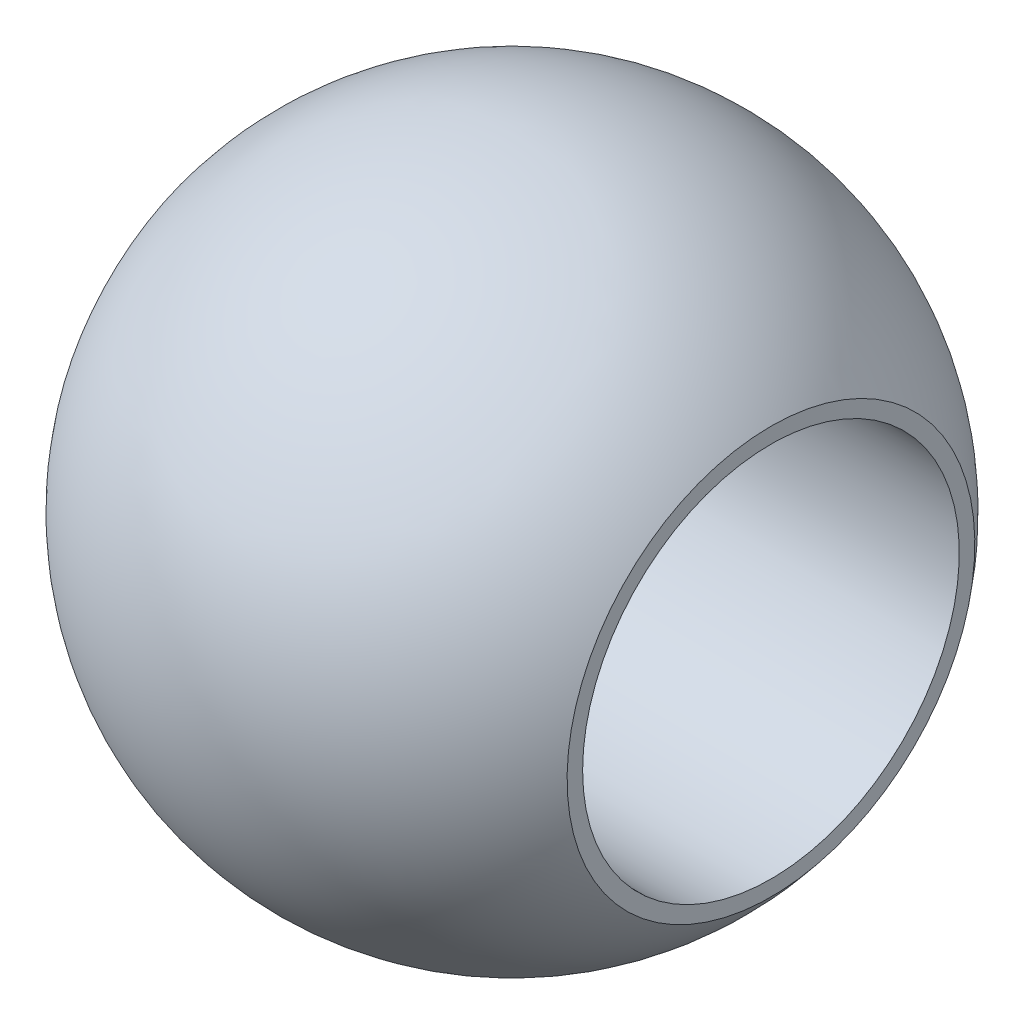
from build123d import *


with BuildPart() as part:
    # Esquisse1 → Base-Révolution (revolve)
    with BuildSketch(Plane.XY, mode=Mode.PRIVATE) as base_r_volution_sk:
        with BuildLine():
            Line((-5.5, 4), (5.5, 4))
            Line((5.5, 4), (5.5, 4.330127019))
            ThreePointArc((5.5, 4.330127019), (0, 7), (-5.5, 4.330127019))
            Line((-5.5, 4.330127019), (-5.5, 4))
        make_face()
    revolve(base_r_volution_sk.sketch.rotate(Axis((-26.541580869, 0, 0), (1, 0, 0)), 90), axis=Axis((-26.541580869, 0, 0), (1, 0, 0)))


solid = part.part
